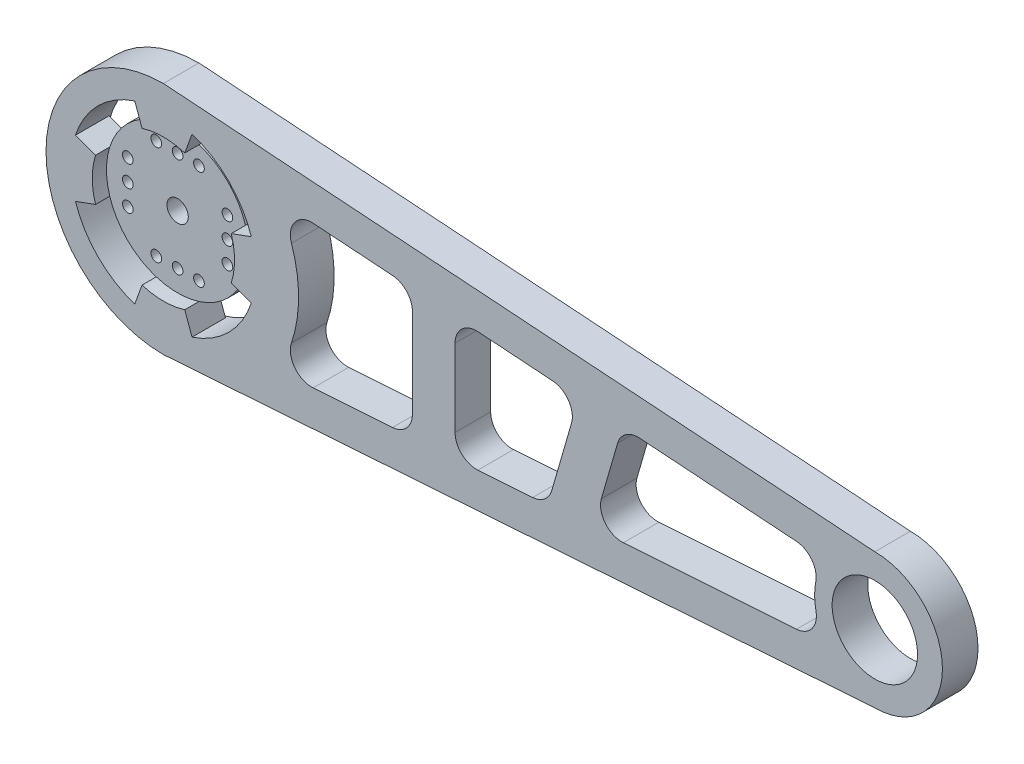
from build123d import *
from build123d.topology import SkipClean

# Parameters (mm, degrees)
SKETCH_1_R          = 6
EXTRUDE_1_DEPTH     = 5
SKETCH_2_R          = 1.5
SKETCH_2_R_2        = 0.75
CUT_EXTRUDE_3_DEPTH = 86.605569128
CUT_EXTRUDE_6_DEPTH = 0.3
CUT_EXTRUDE_8_DEPTH = 86.605569128
CUT_EXTRUDE_START   = -2
SKETCH_9_R          = 10
CUT_EXTRUDE_9_DEPTH = 2


with BuildPart() as part:
    # 草图1 → 凸台-拉伸1 (new body)
    with BuildSketch(Plane.XY):
        with BuildLine():
            Line((-67.351436873, 16.5), (32.648563127, 9.5))
            ThreePointArc((32.648563127, 9.5), (42.148563127, 0), (32.648563127, -9.5))
            Line((32.648563127, -9.5), (-67.351436873, -16.5))
            ThreePointArc((-67.351436873, -16.5), (-83.851436873, 0), (-67.351436873, 16.5))
        make_face()
        with Locations((32.648563127, 0)):
            Circle(SKETCH_1_R, mode=Mode.SUBTRACT)
    extrude(amount=EXTRUDE_1_DEPTH)

    # 草图2 → 切除-拉伸3 (cut, through all)
    with BuildSketch(Plane(origin=(0, 0, 0), x_dir=(-1, 0, 0), z_dir=(0, 0, -1))):
        with Locations((67.351436873, 0)):
            Circle(SKETCH_2_R)
        with Locations((60.351436873, 0)):
            Circle(SKETCH_2_R_2)
        with Locations((60.351436873, 3)):
            Circle(SKETCH_2_R_2)
        with Locations((60.351436873, -3)):
            Circle(SKETCH_2_R_2)
        with Locations((70.351436873, 7)):
            Circle(SKETCH_2_R_2)
        with Locations((67.351436873, 7)):
            Circle(SKETCH_2_R_2)
        with Locations((64.351436873, 7)):
            Circle(SKETCH_2_R_2)
        with Locations((74.351436873, -3)):
            Circle(SKETCH_2_R_2)
        with Locations((74.351436873, 0)):
            Circle(SKETCH_2_R_2)
        with Locations((74.351436873, 3)):
            Circle(SKETCH_2_R_2)
        with Locations((64.351436873, -7)):
            Circle(SKETCH_2_R_2)
        with Locations((67.351436873, -7)):
            Circle(SKETCH_2_R_2)
        with Locations((70.351436873, -7)):
            Circle(SKETCH_2_R_2)
        with BuildLine():
            Line((70.351436873, 9.539392014), (71.378274732, 12.360605845))
            ThreePointArc((71.378274732, 12.360605845), (76.543825029, 9.192388155), (79.712042718, 4.026837859))
            Line((79.712042718, 4.026837859), (76.890828887, 3))
            ThreePointArc((76.890828887, 3), (74.422504685, 7.071067812), (70.351436873, 9.539392014))
        make_face()
        with BuildLine():
            Line((64.351436873, 9.539392014), (63.324599014, 12.360605845))
            ThreePointArc((63.324599014, 12.360605845), (58.159048718, 9.192388155), (54.990831028, 4.026837859))
            Line((54.990831028, 4.026837859), (57.812044859, 3))
            ThreePointArc((57.812044859, 3), (60.280369061, 7.071067812), (64.351436873, 9.539392014))
        make_face()
        with BuildLine():
            Line((76.890828887, -3), (79.712042718, -4.026837859))
            ThreePointArc((79.712042718, -4.026837859), (76.543825029, -9.192388155), (71.378274732, -12.360605845))
            Line((71.378274732, -12.360605845), (70.351436873, -9.539392014))
            ThreePointArc((70.351436873, -9.539392014), (74.422504685, -7.071067812), (76.890828887, -3))
        make_face()
        with BuildLine():
            Line((64.351436873, -9.539392014), (63.324599014, -12.360605845))
            ThreePointArc((63.324599014, -12.360605845), (58.159048718, -9.192388155), (54.990831028, -4.026837859))
            Line((54.990831028, -4.026837859), (57.812044859, -3))
            ThreePointArc((57.812044859, -3), (60.280369061, -7.071067812), (64.351436873, -9.539392014))
        make_face()
    extrude(amount=-CUT_EXTRUDE_3_DEPTH, mode=Mode.SUBTRACT)

    # 草图5 → 切除-拉伸6 (cut)
    with SkipClean():  # the faces are left unmerged after this step: merging them gives an invalid solid
        with BuildSketch(Plane(origin=(0, 0, 0), x_dir=(-1, 0, 0), z_dir=(0, 0, -1))):
            with BuildLine():
                Line((70.351436873, -9.539392014), (71.378274732, -12.360605845))
                ThreePointArc((71.378274732, -12.360605845), (67.351436873, -13), (63.324599014, -12.360605845))
                Line((63.324599014, -12.360605845), (64.351436873, -9.539392014))
                ThreePointArc((64.351436873, -9.539392014), (67.351436873, -10), (70.351436873, -9.539392014))
            make_face()
            with BuildLine():
                Line((57.812044859, -3), (54.990831028, -4.026837859))
                ThreePointArc((54.990831028, -4.026837859), (54.351436873, 0), (54.990831028, 4.026837859))
                Line((54.990831028, 4.026837859), (57.812044859, 3))
                ThreePointArc((57.812044859, 3), (57.351436873, 0), (57.812044859, -3))
            make_face()
            with BuildLine():
                Line((79.712042718, -4.026837859), (76.890828887, -3))
                ThreePointArc((76.890828887, -3), (77.351436873, 0), (76.890828887, 3))
                Line((76.890828887, 3), (79.712042718, 4.026837859))
                ThreePointArc((79.712042718, 4.026837859), (80.351436873, 0), (79.712042718, -4.026837859))
            make_face()
            with BuildLine():
                Line((71.378274732, 12.360605845), (70.351436873, 9.539392014))
                ThreePointArc((70.351436873, 9.539392014), (67.351436873, 10), (64.351436873, 9.539392014))
                Line((64.351436873, 9.539392014), (63.324599014, 12.360605845))
                ThreePointArc((63.324599014, 12.360605845), (67.351436873, 13), (71.378274732, 12.360605845))
            make_face()
        extrude(amount=-CUT_EXTRUDE_6_DEPTH, mode=Mode.SUBTRACT)

    # 草图7 → 切除-拉伸8 (cut, through all)
    with SkipClean():  # the faces are left unmerged after this step: merging them gives an invalid solid
        with BuildSketch(Plane.XY.offset(5)):
            with BuildLine():
                Line((-32.351436873, 6.240423951), (-32.351436873, -6.279908436))
                ThreePointArc((-32.351436873, -6.279908436), (-33.159771035, -8.328469115), (-35.149170775, -9.273082074))
                Line((-35.149170775, -9.273082074), (-46.303856397, -10.026868861))
                ThreePointArc((-46.303856397, -10.026868861), (-48.882666549, -8.864552498), (-49.348665365, -6.074554966))
                ThreePointArc((-49.348665365, -6.074554966), (-48.351437761, -0.005807318), (-49.344955374, 6.063548799))
                ThreePointArc((-49.344955374, 6.063548799), (-48.875599725, 8.855399851), (-46.292339334, 10.013628142))
                Line((-46.292339334, 10.013628142), (-35.14194949, 9.233100853))
                ThreePointArc((-35.14194949, 9.233100853), (-33.157301263, 8.286339132), (-32.351436873, 6.240423951))
            make_face()
            with BuildLine():
                Line((-23.14194949, 8.393100853), (-12.658599808, 7.659266375))
                ThreePointArc((-12.658599808, 7.659266375), (-10.408556973, 6.384352876), (-9.986244931, 3.832931757))
                Line((-9.986244931, 3.832931757), (-12.767703456, -5.782195127))
                ThreePointArc((-12.767703456, -5.782195127), (-13.767045159, -7.284386647), (-15.447279617, -7.941711049))
                Line((-15.447279617, -7.941711049), (-23.149170775, -8.462172493))
                ThreePointArc((-23.149170775, -8.462172493), (-25.399997551, -7.660664694), (-26.351436873, -5.468998855))
                Line((-26.351436873, -5.468998855), (-26.351436873, 5.400423951))
                ThreePointArc((-26.351436873, 5.400423951), (-25.397352054, 7.594559561), (-23.14194949, 8.393100853))
            make_face()
            with BuildLine():
                Line((-3.505857343, 4.643162142), (-5.790312558, -3.25389135))
                ThreePointArc((-5.790312558, -3.25389135), (-5.244319535, -5.970049623), (-2.7062042, -7.080722705))
                Line((-2.7062042, -7.080722705), (21.637024401, -5.435709596))
                ThreePointArc((21.637024401, -5.435709596), (23.82451027, -4.256119574), (24.371955288, -1.831901968))
                ThreePointArc((24.371955288, -1.831901968), (24.183794233, -0.066811207), (24.345729084, 1.700878551))
                ThreePointArc((24.345729084, 1.700878551), (23.778220575, 4.09624397), (21.609277414, 5.26051497))
                Line((21.609277414, 5.26051497), (-0.414527699, 6.802181327))
                ThreePointArc((-0.414527699, 6.802181327), (-2.341778485, 6.269034644), (-3.505857343, 4.643162142))
            make_face()
        extrude(amount=-CUT_EXTRUDE_8_DEPTH, mode=Mode.SUBTRACT)

    # 草图9 → 切除-拉伸9 (cut)
    with SkipClean():  # the faces are left unmerged after this step: merging them gives an invalid solid
        with BuildSketch(Plane.XY.offset(5).offset(CUT_EXTRUDE_START)):
            with Locations(Location((-67.351436873, 0, 0), (0, 0, 180))):
                Circle(SKETCH_9_R)
        extrude(amount=CUT_EXTRUDE_9_DEPTH, mode=Mode.SUBTRACT)


solid = part.part
